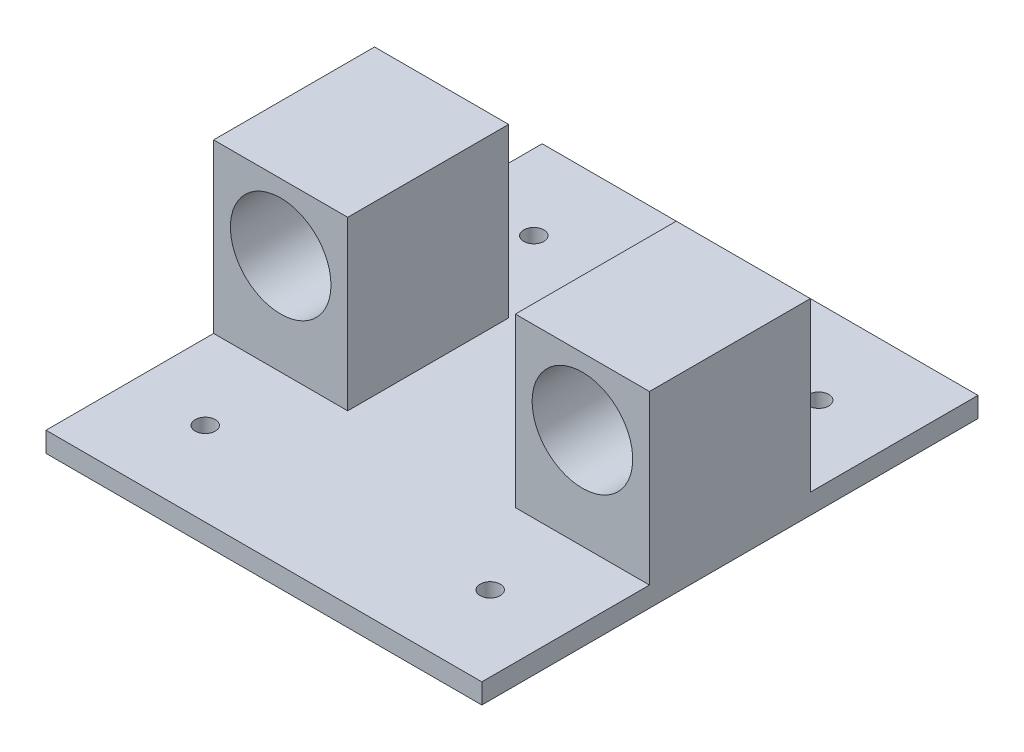
from build123d import *

# Parameters (mm, degrees)
BOSS_EXTRUDE1_DEPTH = 12
SKETCH2_R           = 7.5
CUT_EXTRUDE1_DEPTH  = 50.155365933
SKETCH3_W           = 65
SKETCH3_H           = 3
BOSS_EXTRUDE2_DEPTH = 25
SKETCH4_R           = 1.5
CUT_EXTRUDE2_DEPTH  = 56.229068433


with BuildPart() as part:
    # Sketch1 → Boss-Extrude1 (new, symmetric)
    with BuildSketch(Plane.XY):
        Polygon((32.5, 0), (-32.5, 0), (-32.5, 28), (-12.5, 28), (-12.5, 3), (12.5, 3), (12.5, 28), (32.5, 28), align=None)
    extrude(amount=BOSS_EXTRUDE1_DEPTH, both=True)

    # Sketch2 → Cut-Extrude1 (cut, through all)
    with BuildSketch(Plane.XY.offset(12)):
        with Locations((-22.5, 18)):
            Circle(SKETCH2_R)
    cut_extrude1 = extrude(amount=-CUT_EXTRUDE1_DEPTH, mode=Mode.SUBTRACT)

    # Mirror1: Cut-Extrude1 across plane
    add(cut_extrude1.mirror(Plane(origin=(0, 0, 0), x_dir=(0, 0, 1), z_dir=(1, 0, 0))), mode=Mode.SUBTRACT)

    # Sketch3 → Boss-Extrude2 (add)
    with BuildSketch(Plane.XY.offset(12)):
        with Locations((0, 1.5)):
            Rectangle(SKETCH3_W, SKETCH3_H)
    boss_extrude2 = extrude(amount=BOSS_EXTRUDE2_DEPTH)

    # Sketch4 → Cut-Extrude2 (cut, symmetric)
    with BuildSketch(Plane(origin=(0, 3, 0), x_dir=(1, 0, 0), z_dir=(0, 1, 0))):
        with Locations(Location((-21.25, -24.5, 0), (0, 0, 270))):
            Circle(SKETCH4_R)
        with Locations(Location((21.25, -24.5, 0), (0, 0, 270))):
            Circle(SKETCH4_R)
    cut_extrude2 = extrude(amount=CUT_EXTRUDE2_DEPTH, both=True, mode=Mode.SUBTRACT)

    # Mirror2: Boss-Extrude2, Cut-Extrude2 across plane
    add(boss_extrude2.mirror(Plane.XY))
    add(cut_extrude2.mirror(Plane.XY), mode=Mode.SUBTRACT)


solid = part.part
